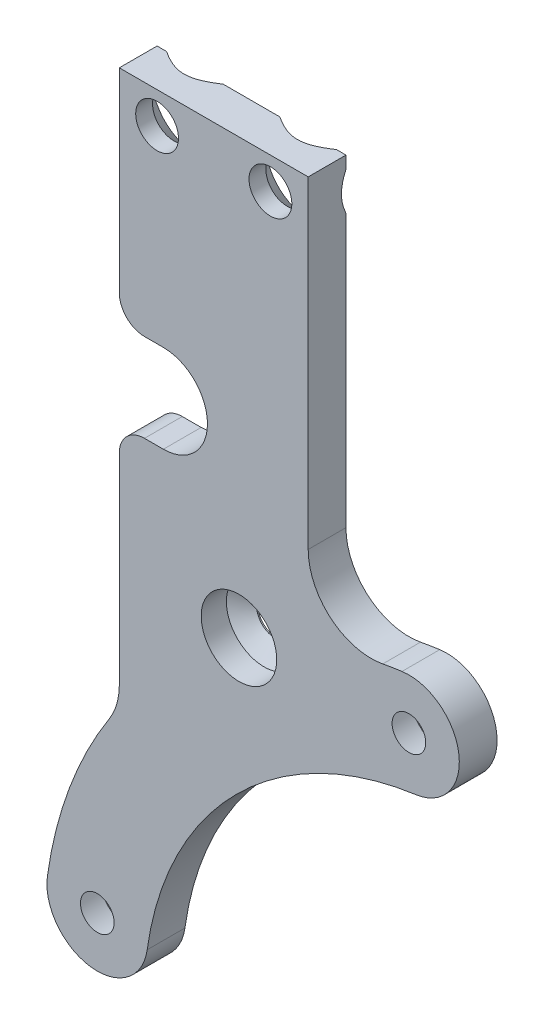
from build123d import *

# Parameters (mm, degrees)
RESSALTO_EXTRUS_O1_DEPTH                = 3
BROCA_DE_ROSQUEAR_PARA_TARRAXA_DE_M31_D = 2.5
FURO_DE_DI_METRO_6_0_6_1_D              = 6
FURO_DE_DI_METRO_6_0_6_1_DEPTH          = 2
FURO_DE_DI_METRO_6_0_6_1_TIP            = 1.802581857
ESCAREADO_PARA_SFHCS_M31_D              = 3.4
ESCAREADO_PARA_SFHCS_M31_DEPTH          = 10
ESCAREADO_PARA_SFHCS_M31_CSINK_D        = 6.72
ESCAREADO_PARA_SFHCS_M31_CSINK_ANGLE    = 90
ESCAREADO_PARA_SFHCS_M31_TIP            = 1.021463052
ESBO_O10_R                              = 1.5
CORTE_EXTRUS_O1_DEPTH                   = 72.066727781
FILETE1_R                               = 2
FILETE2_R                               = 5
FURO_DE_DI_METRO_6_0_6_2_D              = 6
FURO_DE_DI_METRO_6_0_6_2_DEPTH          = 2
FURO_DE_DI_METRO_6_0_6_2_TIP            = 1.802581857


with BuildPart() as part:
    # Esboço1 → Ressalto-extrusão1 (new body)
    with BuildSketch(Plane.XY):
        with BuildLine():
            Line((-12, 30.768414179), (-12, 63))
            Line((-12, 63), (-27, 63))
            Line((-27, 63), (-27, 19.018288858))
            ThreePointArc((-27, 19.018288858), (-30.719082421, 12.125728279), (-32.710572622, 4.551236075))
            ThreePointArc((-32.710572622, 4.551236075), (-29.299973416, 0.038164719), (-24.786902061, 3.448763925))
            ThreePointArc((-24.786902061, 3.448763925), (-17.695825587, 17.695825587), (-3.448763925, 24.786902061))
            ThreePointArc((-3.448763925, 24.786902061), (-0.038164719, 29.299973416), (-4.551236075, 32.710572622))
            ThreePointArc((-4.551236075, 32.710572622), (-8.332397539, 31.957259931), (-12, 30.768414179))
        make_face()
    extrude(amount=RESSALTO_EXTRUS_O1_DEPTH)

    # Broca de rosquear para tarraxa de M31 (through all)
    with Locations(Plane.XY.offset(3)):
        with Locations((-28.748737342, 4), (-4, 28.748737342)):
            Hole(BROCA_DE_ROSQUEAR_PARA_TARRAXA_DE_M31_D / 2)

    # Furo de diâmetro Ø6.0 (6)1
    with Locations(Plane(origin=(0, 0, 0), x_dir=(-1, 0, 0), z_dir=(0, 0, -1))):
        with Locations((28.748737342, 4), (4, 28.748737342)):
            Hole(FURO_DE_DI_METRO_6_0_6_1_D / 2, depth=FURO_DE_DI_METRO_6_0_6_1_DEPTH)
            with Locations((0, 0, -(FURO_DE_DI_METRO_6_0_6_1_DEPTH + FURO_DE_DI_METRO_6_0_6_1_TIP / 2))):  # 118° drill point
                Cone(0, FURO_DE_DI_METRO_6_0_6_1_D / 2, FURO_DE_DI_METRO_6_0_6_1_TIP, mode=Mode.SUBTRACT)

    # Escareado para SFHCS M31
    with Locations(Plane(origin=(0, 0, 0), x_dir=(-1, 0, 0), z_dir=(0, 0, -1))):
        with Locations((15, 60.5), (24, 60.5)):
            CounterSinkHole(ESCAREADO_PARA_SFHCS_M31_D / 2, ESCAREADO_PARA_SFHCS_M31_CSINK_D / 2, depth=ESCAREADO_PARA_SFHCS_M31_DEPTH, counter_sink_angle=ESCAREADO_PARA_SFHCS_M31_CSINK_ANGLE)
            with Locations((0, 0, -(ESCAREADO_PARA_SFHCS_M31_DEPTH + ESCAREADO_PARA_SFHCS_M31_TIP / 2))):  # 118° drill point
                Cone(0, ESCAREADO_PARA_SFHCS_M31_D / 2, ESCAREADO_PARA_SFHCS_M31_TIP, mode=Mode.SUBTRACT)

    # Esboço10 → Corte-extrusão1 (cut, through all)
    with BuildSketch(Plane(origin=(0, 0, 0), x_dir=(-1, 0, 0), z_dir=(0, 0, -1))):
        with Locations((17.498454448, 28.544464197)):
            Circle(ESBO_O10_R)
        with BuildLine():
            Line((23.5, 45.518288858), (27, 45.518288858))
            Line((27, 45.518288858), (27, 38.518288858))
            Line((27, 38.518288858), (23.5, 38.518288858))
            ThreePointArc((23.5, 38.518288858), (20, 42.018288858), (23.5, 45.518288858))
        make_face()
    extrude(amount=-CORTE_EXTRUS_O1_DEPTH, mode=Mode.SUBTRACT)

    # Filete1
    filete1_edges = [part.edges().sort_by_distance(p)[0] for p in [
        (-27, 45.518288858, 1.5),
        (-27, 38.518288858, 1.5),
    ]]
    fillet(filete1_edges, radius=FILETE1_R)

    # Filete2
    filete2_edges = [part.edges().sort_by_distance(p)[0] for p in [
        (-27, 19.018288858, 1.5),
        (-12, 30.768414179, 1.5),
    ]]
    fillet(filete2_edges, radius=FILETE2_R)

    # Furo de diâmetro Ø6.0 (6)2
    with Locations(Plane.XY.offset(3)):
        with Locations((-17.498454448, 28.544464197)):
            Hole(FURO_DE_DI_METRO_6_0_6_2_D / 2, depth=FURO_DE_DI_METRO_6_0_6_2_DEPTH)
            with Locations((0, 0, -(FURO_DE_DI_METRO_6_0_6_2_DEPTH + FURO_DE_DI_METRO_6_0_6_2_TIP / 2))):  # 118° drill point
                Cone(0, FURO_DE_DI_METRO_6_0_6_2_D / 2, FURO_DE_DI_METRO_6_0_6_2_TIP, mode=Mode.SUBTRACT)


solid = part.part
